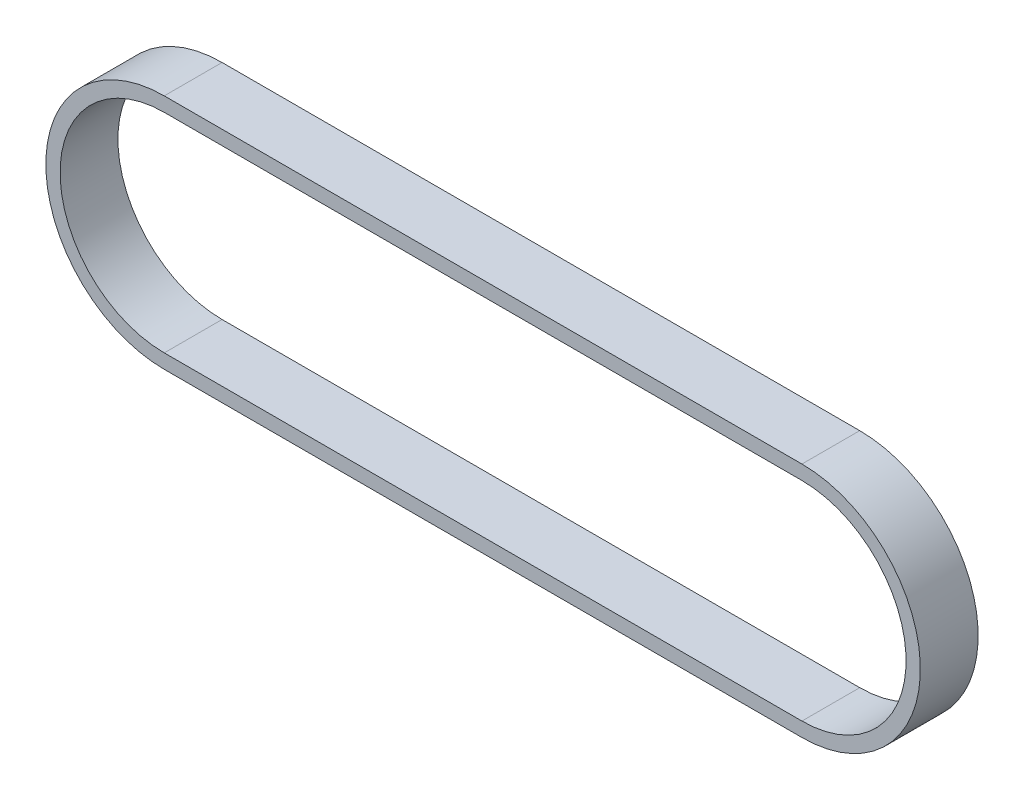
from build123d import *

# Parameters (mm, degrees)
RESSALTO_EXTRUS_O1_DEPTH = 9.52


with BuildPart() as part:
    # Esboço1 → Ressalto-extrusão1 (new body)
    with BuildSketch(Plane.XY):
        with BuildLine():
            Line((0, 19.5), (105, 19.5))
            ThreePointArc((105, 19.5), (124.5, 0), (105, -19.5))
            Line((105, -19.5), (0, -19.5))
            ThreePointArc((0, -19.5), (-19.5, 0), (0, 19.5))
        make_face()
        with BuildLine():
            Line((0, 17.15), (105, 17.15))
            ThreePointArc((105, 17.15), (122.15, 0), (105, -17.15))
            Line((105, -17.15), (0, -17.15))
            ThreePointArc((0, -17.15), (-17.15, 0), (0, 17.15))
        make_face(mode=Mode.SUBTRACT)
    extrude(amount=RESSALTO_EXTRUS_O1_DEPTH)


solid = part.part
